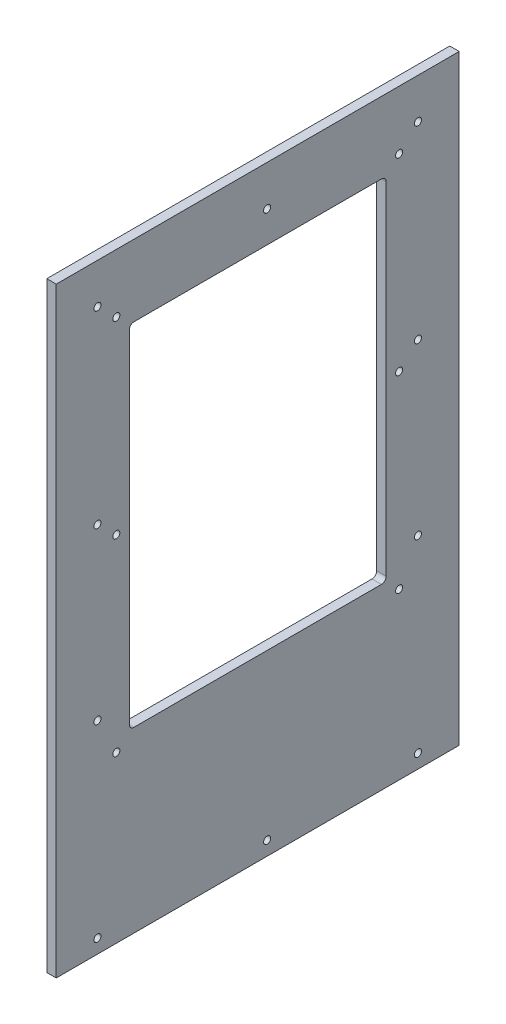
from build123d import *

# Parameters (mm, degrees)
SKETCH1_W           = 542.925
SKETCH1_H           = 809.625
BOSS_EXTRUDE1_DEPTH = 12.7
SKETCH2_R           = 4.7625
CUT_EXTRUDE1_DEPTH  = 12.7
SKETCH3_R           = 4.7625
CUT_EXTRUDE2_DEPTH  = 12.7
SKETCH6_R           = 4.7625
CUT_EXTRUDE4_DEPTH  = 12.7
SKETCH7_R           = 4.7625
CUT_EXTRUDE5_DEPTH  = 12.7
SKETCH9_W           = 346.075
SKETCH9_H           = 473.075
CUT_EXTRUDE6_DEPTH  = 12.7
FILLET1_R           = 6.35


with BuildPart() as part:
    # Sketch1 → Boss-Extrude1 (new body)
    with BuildSketch(Plane(origin=(0, 0, 0), x_dir=(0, 0, -1), z_dir=(1, 0, 0))):
        Rectangle(SKETCH1_W, SKETCH1_H)
    extrude(amount=BOSS_EXTRUDE1_DEPTH)

    # Sketch2 → Cut-Extrude1 (cut)
    with BuildSketch(Plane(origin=(12.7, 0, 0), x_dir=(0, 0, -1), z_dir=(1, 0, 0))):
        with Locations((-215.9, 350.52)):
            Circle(SKETCH2_R)
        with Locations((215.9, 350.52)):
            Circle(SKETCH2_R)
        with Locations((-215.9, -386.08)):
            Circle(SKETCH2_R)
        with Locations((215.9, -386.08)):
            Circle(SKETCH2_R)
    extrude(amount=-CUT_EXTRUDE1_DEPTH, mode=Mode.SUBTRACT)

    # Sketch3 → Cut-Extrude2 (cut)
    with BuildSketch(Plane(origin=(12.7, 0, 0), x_dir=(0, 0, -1), z_dir=(1, 0, 0))):
        with Locations((-215.9, 96.52)):
            Circle(SKETCH3_R)
        with Locations((-215.9, -132.08)):
            Circle(SKETCH3_R)
        with Locations((12.7, 350.52)):
            Circle(SKETCH3_R)
        with Locations((12.7, -386.08)):
            Circle(SKETCH3_R)
        with Locations(Location((215.9, -132.08, 0), (0, 0, 180))):
            Circle(SKETCH3_R)
        with Locations(Location((215.9, 96.52, 0), (0, 0, 180))):
            Circle(SKETCH3_R)
    extrude(amount=-CUT_EXTRUDE2_DEPTH, mode=Mode.SUBTRACT)

    # Sketch6 → Cut-Extrude4 (cut)
    with BuildSketch(Plane.ZY):
        with Locations((-190.5, 325.91375)):
            Circle(SKETCH6_R)
        with Locations((190.5, 325.91375)):
            Circle(SKETCH6_R)
        with Locations((-190.5, -182.08625)):
            Circle(SKETCH6_R)
        with Locations((190.5, -182.08625)):
            Circle(SKETCH6_R)
    extrude(amount=-CUT_EXTRUDE4_DEPTH, mode=Mode.SUBTRACT)

    # Sketch7 → Cut-Extrude5 (cut)
    with BuildSketch(Plane.ZY):
        with Locations((-190.5, 71.91375)):
            Circle(SKETCH7_R)
        with Locations((190.5, 71.91375)):
            Circle(SKETCH7_R)
    extrude(amount=-CUT_EXTRUDE5_DEPTH, mode=Mode.SUBTRACT)

    # Sketch9 → Cut-Extrude6 (cut)
    with BuildSketch(Plane(origin=(12.7, 0, 0), x_dir=(0, 0, -1), z_dir=(1, 0, 0))):
        with Locations((0, 71.91375)):
            Rectangle(SKETCH9_W, SKETCH9_H)
    extrude(amount=-CUT_EXTRUDE6_DEPTH, mode=Mode.SUBTRACT)

    # Fillet1
    fillet1_edges = [part.edges().sort_by_distance(p)[0] for p in [
        (6.35, -164.62375, -173.0375),
        (6.35, -164.62375, 173.0375),
        (6.35, 308.45125, 173.0375),
        (6.35, 308.45125, -173.0375),
    ]]
    fillet(fillet1_edges, radius=FILLET1_R)


solid = part.part
